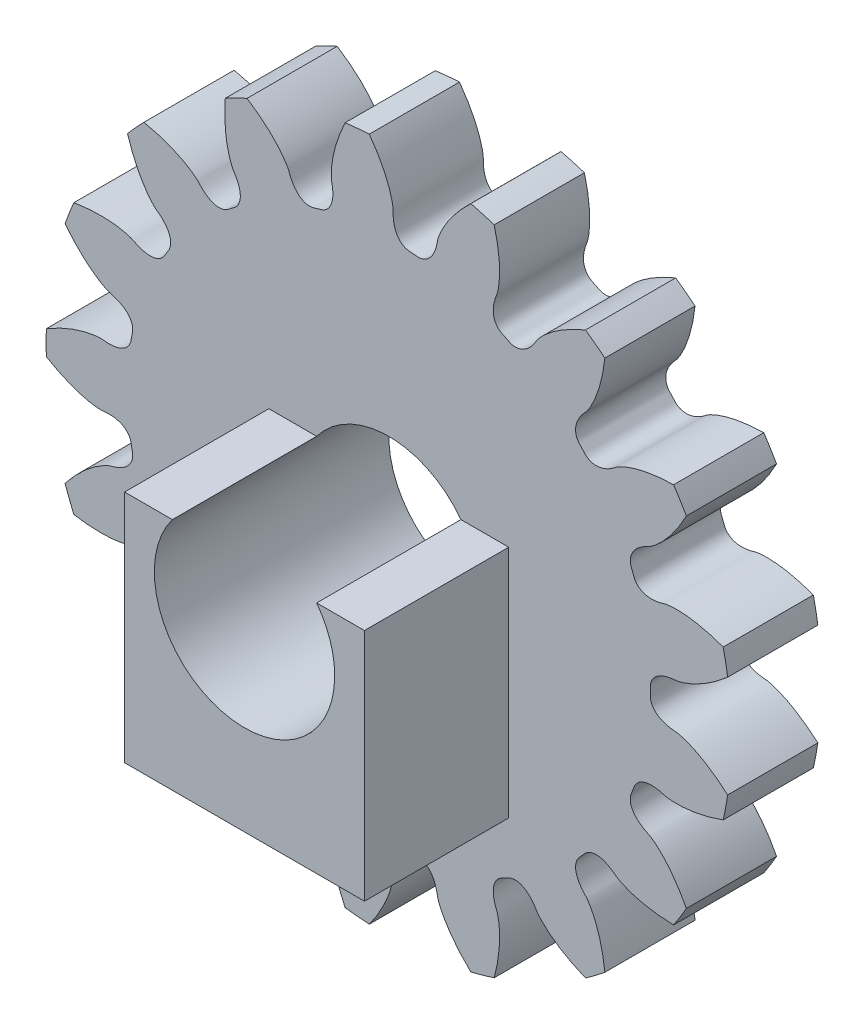
from build123d import *

# Parameters (mm, degrees)
SKETCH_352_W               = 5
SKETCH_352_H               = 18.999999715
CUT_EXTRUDE_708_DEPTH      = 10
PATTERN_CIRCULAR_762_COUNT = 17
SKETCH_797_W               = 20
SKETCH_797_H               = 5
EXTRUDE_START              = 8
EXTRUDE_1_DEPTH            = 8


with BuildPart() as part:
    # Sketch 352 → Revolve 423 (revolve)
    with BuildSketch(Plane(origin=(0, 0, 0), x_dir=(0, 0, -1), z_dir=(1, 0, 0))):
        with Locations((0, 9.499999858)):
            Rectangle(SKETCH_352_W, SKETCH_352_H)
    revolve(axis=Axis((0, 0, 0), (0, 0, -1)))

    # Sketch 468 → Cut-Extrude 708 (cut, symmetric)
    with BuildSketch(Plane.XY):
        with BuildLine():
            ThreePointArc((18.877658909, 2.905853259), (19.099999713, 0), (18.877658909, -2.905853259))
            add(Edge.make_bspline(
                [(18.877658909, -2.905853259), (18.835689919, -2.868075465), (18.772679359, -2.812273245), (18.688294724, -2.739384033), (18.625786196, -2.686278703), (18.563667492, -2.634374694), (18.501954044, -2.58366201), (18.440661146, -2.53413048), (18.379803953, -2.485769767), (18.31939748, -2.438569361), (18.259456596, -2.392518588), (18.199996026, -2.347606607), (18.141030349, -2.303822415), (18.082573994, -2.261154845), (18.024641242, -2.219592572), (17.96724622, -2.179124111), (17.910402903, -2.13973782), (17.854125112, -2.101421903), (17.798426509, -2.06416441), (17.743320599, -2.02795324), (17.688820728, -1.99277614), (17.63494008, -1.958620713), (17.581691675, -1.925474413), (17.529088372, -1.89332455), (17.47714286, -1.862158293), (17.425867663, -1.831962669), (17.375275138, -1.802724566), (17.325377469, -1.774430737), (17.276186669, -1.747067799), (17.227714579, -1.720622237), (17.179972866, -1.695080402), (17.132973019, -1.67042852), (17.086726353, -1.646652688), (17.041244003, -1.623738878), (16.996536924, -1.601672937), (16.952615892, -1.580440595), (16.9094915, -1.560027459), (16.867174158, -1.540419022), (16.825674089, -1.521600658), (16.785001335, -1.503557633), (16.745165747, -1.486275099), (16.70617699, -1.469738098), (16.668044539, -1.453931569), (16.630777681, -1.438840343), (16.594385508, -1.424449149), (16.558876923, -1.410742618), (16.524260634, -1.39770528), (16.490545155, -1.38532157), (16.457738805, -1.373575829), (16.425849705, -1.362452304), (16.394885782, -1.351935156), (16.364854762, -1.342008457), (16.335764172, -1.332656191), (16.307621341, -1.323862262), (16.280433396, -1.315610493), (16.254207262, -1.307884627), (16.228949662, -1.30066833), (16.204667116, -1.293945195), (16.181365939, -1.287698744), (16.159052243, -1.281912425), (16.137731934, -1.276569623), (16.117410711, -1.271653656), (16.098094066, -1.267147778), (16.079787284, -1.263035183), (16.062495444, -1.259299008), (16.046223413, -1.25592233), (16.03097585, -1.252888176), (16.016757206, -1.250179519), (16.003571719, -1.247779285), (15.991423417, -1.245670348), (15.980316117, -1.243835552), (15.970253428, -1.242257651), (15.961238729, -1.240919512), (15.953275244, -1.239803485), (15.946365806, -1.238893357), (15.940513566, -1.238168495), (15.878189921, -1.231047832), (15.798825389, -1.228018318), (15.703655474, -1.215953784), (15.649467969, -1.208331184), (15.596258655, -1.199646604), (15.54400388, -1.190006734), (15.492690847, -1.179373441), (15.442301514, -1.167741381), (15.392816806, -1.155090622), (15.344215565, -1.141398119), (15.296474978, -1.126633588), (15.249570732, -1.110759317), (15.203477429, -1.093728751), (15.158169165, -1.075485196), (15.113620398, -1.05596029), (15.069807181, -1.035072325), (15.026708876, -1.012724457), (14.984310506, -0.988802839), (14.942605916, -0.963174827), (14.901601952, -0.935687429), (14.861323874, -0.906166316), (14.821822218, -0.874415841), (14.78318124, -0.840220712), (14.745528928, -0.803350183), (14.709048241, -0.76356583), (14.67398879, -0.720634147), (14.640677395, -0.674345103), (14.609525194, -0.624537363), (14.581027601, -0.571129886), (14.555754764, -0.514157513), (14.534322936, -0.45380698), (14.517368695, -0.390442448), (14.50543648, -0.324626756), (14.499650458, -0.262572046), (14.497192375, -0.154189358), (14.502240728, 0), (14.497192375, 0.154189358), (14.499650458, 0.262572046), (14.50543648, 0.324626756), (14.517368695, 0.390442448), (14.534322936, 0.45380698), (14.555754764, 0.514157513), (14.581027601, 0.571129886), (14.609525194, 0.624537363), (14.640677395, 0.674345103), (14.67398879, 0.720634147), (14.709048241, 0.76356583), (14.745528928, 0.803350183), (14.78318124, 0.840220712), (14.821822218, 0.874415841), (14.861323874, 0.906166316), (14.901601952, 0.935687429), (14.942605916, 0.963174827), (14.984310506, 0.988802839), (15.026708876, 1.012724457), (15.069807181, 1.035072325), (15.113620398, 1.05596029), (15.158169165, 1.075485196), (15.203477429, 1.093728751), (15.249570732, 1.110759317), (15.296474978, 1.126633588), (15.344215565, 1.141398119), (15.392816806, 1.155090622), (15.442301514, 1.167741381), (15.492690847, 1.179373441), (15.54400388, 1.190006734), (15.596258655, 1.199646604), (15.649467969, 1.208331184), (15.703655474, 1.215953784), (15.798825389, 1.228018318), (15.878189921, 1.231047832), (15.940513566, 1.238168495), (15.946365806, 1.238893357), (15.953275244, 1.239803485), (15.961238729, 1.240919512), (15.970253428, 1.242257651), (15.980316117, 1.243835552), (15.991423417, 1.245670348), (16.003571719, 1.247779285), (16.016757206, 1.250179519), (16.03097585, 1.252888176), (16.046223413, 1.25592233), (16.062495444, 1.259299008), (16.079787284, 1.263035183), (16.098094066, 1.267147778), (16.117410711, 1.271653656), (16.137731934, 1.276569623), (16.159052243, 1.281912425), (16.181365939, 1.287698744), (16.204667116, 1.293945195), (16.228949662, 1.30066833), (16.254207262, 1.307884627), (16.280433396, 1.315610493), (16.307621341, 1.323862262), (16.335764172, 1.332656191), (16.364854762, 1.342008457), (16.394885782, 1.351935156), (16.425849705, 1.362452304), (16.457738805, 1.373575829), (16.490545155, 1.38532157), (16.524260634, 1.39770528), (16.558876923, 1.410742618), (16.594385508, 1.424449149), (16.630777681, 1.438840343), (16.668044539, 1.453931569), (16.70617699, 1.469738098), (16.745165747, 1.486275099), (16.785001335, 1.503557633), (16.825674089, 1.521600658), (16.867174158, 1.540419022), (16.9094915, 1.560027459), (16.952615892, 1.580440595), (16.996536924, 1.601672937), (17.041244003, 1.623738878), (17.086726353, 1.646652688), (17.132973019, 1.67042852), (17.179972866, 1.695080402), (17.227714579, 1.720622237), (17.276186669, 1.747067799), (17.325377469, 1.774430737), (17.375275138, 1.802724566), (17.425867663, 1.831962669), (17.47714286, 1.862158293), (17.529088372, 1.89332455), (17.581691675, 1.925474413), (17.63494008, 1.958620713), (17.688820728, 1.99277614), (17.743320599, 2.02795324), (17.798426509, 2.06416441), (17.854125112, 2.101421903), (17.910402903, 2.13973782), (17.96724622, 2.179124111), (18.024641242, 2.219592572), (18.082573994, 2.261154845), (18.141030349, 2.303822415), (18.199996026, 2.347606607), (18.259456596, 2.392518588), (18.31939748, 2.438569361), (18.379803953, 2.485769767), (18.440661146, 2.53413048), (18.501954044, 2.58366201), (18.563667492, 2.634374694), (18.625786196, 2.686278703), (18.688294724, 2.739384033), (18.772679359, 2.812273245), (18.835689919, 2.868075465), (18.877658909, 2.905853259)],
                knots=[0, 0, 0, 0, 0.015162032, 0.022599105, 0.029940215, 0.037185363, 0.044334549, 0.051387773, 0.058345034, 0.065206333, 0.071971671, 0.078641045, 0.085214458, 0.091691908, 0.098073396, 0.104358922, 0.110548486, 0.116642087, 0.122639727, 0.128541404, 0.134347118, 0.140056871, 0.145670661, 0.151188489, 0.156610355, 0.161936259, 0.1671662, 0.172300179, 0.177338196, 0.182280251, 0.187126343, 0.191876474, 0.196530642, 0.201088847, 0.205551091, 0.209917372, 0.214187691, 0.218362048, 0.222440443, 0.226422875, 0.230309346, 0.234099854, 0.237794399, 0.241392983, 0.244895604, 0.248302263, 0.25161296, 0.254827695, 0.257946467, 0.260969277, 0.263896125, 0.266727011, 0.269461934, 0.272100896, 0.274643895, 0.277090931, 0.279442006, 0.281697118, 0.283856269, 0.285919456, 0.287886682, 0.289757946, 0.291533247, 0.293212586, 0.294795962, 0.296283377, 0.297674829, 0.298970319, 0.300169847, 0.301273413, 0.302281016, 0.303192657, 0.304008336, 0.304728053, 0.305351807, 0.3058796, 0.30631143, 0.322194946, 0.327167519, 0.332064219, 0.33688808, 0.341642437, 0.346330959, 0.350957696, 0.355527114, 0.360044151, 0.364514266, 0.368943504, 0.373338556, 0.377706832, 0.382056531, 0.386396718, 0.390737396, 0.395089566, 0.399465282, 0.403877663, 0.408340876, 0.412870037, 0.417481027, 0.422190173, 0.42701375, 0.431967282, 0.437064588, 0.442316586, 0.447729887, 0.453305293, 0.459036399, 0.464908574, 0.470898646, 0.476975559, 0.48162129, 0.5, 0.51837871, 0.523024441, 0.529101354, 0.535091426, 0.540963601, 0.546694707, 0.552270113, 0.557683414, 0.562935412, 0.568032718, 0.57298625, 0.577809827, 0.582518973, 0.587129963, 0.591659124, 0.596122337, 0.600534718, 0.604910434, 0.609262604, 0.613603282, 0.617943469, 0.622293168, 0.626661444, 0.631056496, 0.635485734, 0.639955849, 0.644472886, 0.649042304, 0.653669041, 0.658357563, 0.66311192, 0.667935781, 0.672832481, 0.677805054, 0.69368857, 0.6941204, 0.694648193, 0.695271947, 0.695991664, 0.696807343, 0.697718984, 0.698726587, 0.699830153, 0.701029681, 0.702325171, 0.703716623, 0.705204038, 0.706787414, 0.708466753, 0.710242054, 0.712113318, 0.714080544, 0.716143731, 0.718302882, 0.720557994, 0.722909069, 0.725356105, 0.727899104, 0.730538066, 0.733272989, 0.736103875, 0.739030723, 0.742053533, 0.745172305, 0.74838704, 0.751697737, 0.755104396, 0.758607017, 0.762205601, 0.765900146, 0.769690654, 0.773577125, 0.777559557, 0.781637952, 0.785812309, 0.790082628, 0.794448909, 0.798911153, 0.803469358, 0.808123526, 0.812873657, 0.817719749, 0.822661804, 0.827699821, 0.8328338, 0.838063741, 0.843389645, 0.848811511, 0.854329339, 0.859943129, 0.865652882, 0.871458596, 0.877360273, 0.883357913, 0.889451514, 0.895641078, 0.901926604, 0.908308092, 0.914785542, 0.921358955, 0.928028329, 0.934793667, 0.941654966, 0.948612227, 0.955665451, 0.962814637, 0.970059785, 0.977400895, 0.984837968, 1, 1, 1, 1], degree=3))
        make_face()
    cut_extrude_708 = extrude(amount=CUT_EXTRUDE_708_DEPTH, both=True, mode=Mode.SUBTRACT)

    # Pattern Circular 762: Cut-Extrude 708 ×17 about axis
    pattern_circular_762_axis = Axis((0, 0, 55), (0, 0, -1))
    for i in range(1, PATTERN_CIRCULAR_762_COUNT):
        add(cut_extrude_708.rotate(pattern_circular_762_axis, i * 360 / PATTERN_CIRCULAR_762_COUNT), mode=Mode.SUBTRACT)

    # Sketch 797 → Cut-Revolve 837 (revolve, cut)
    with BuildSketch(Plane(origin=(0, 0, 0), x_dir=(0, 0, -1), z_dir=(1, 0, 0))):
        with Locations((0, 2.5)):
            Rectangle(SKETCH_797_W, SKETCH_797_H)
    revolve(axis=Axis((0, 0, 0), (0, 0, -1)), mode=Mode.SUBTRACT)

    # 草图1 → 凸台-拉伸1 (add)
    with BuildSketch(Plane.XY.offset(2.5).offset(EXTRUDE_START)):
        with BuildLine():
            Line((-6.65, 3), (-4, 3))
            ThreePointArc((-4, 3), (0, -5), (4, 3))
            Line((4, 3), (6.65, 3))
            Line((6.65, 3), (6.65, -10))
            Line((6.65, -10), (-6.65, -10))
            Line((-6.65, -10), (-6.65, 3))
        make_face()
    extrude(amount=-EXTRUDE_1_DEPTH)


solid = part.part
